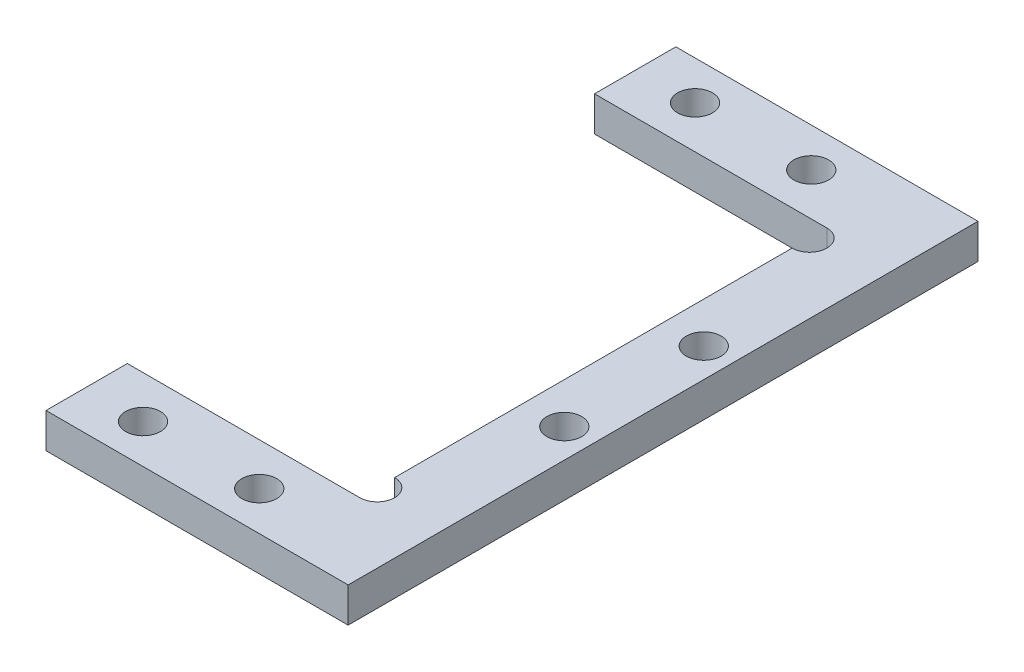
from build123d import *

# Parameters (mm, degrees)
SKETCH_1_W             = 38
SKETCH_1_H             = 7
EXTRUDE_1_DEPTH        = 3
SKETCH_2_W             = 7
SKETCH_2_H             = 3
EXTRUDE_2_DEPTH        = 13
SKETCH_3_R             = 1.5
CUT_EXTRUDE_1_DEPTH    = 44.0464865
SKETCH_4_R             = 1.5
CUT_EXTRUDE_2_DEPTH    = 44.0464865
SKETCH_5_W             = 5
SKETCH_5_H             = 40.2
EXTRUDE_3_DEPTH        = 3
SKETCH_6_R             = 1.5
CUT_EXTRUDE_3_DEPTH    = 56.398916957
FILLET_1_R             = 5
FILLET_2_R             = 5
FILLET_2_OF_MIRROR_1_R = 5
SKETCH_7_W             = 73.096836427
SKETCH_7_H             = 5.118381576
CUT_EXTRUDE_4_DEPTH    = 13
SKETCH_9_W             = 54.2
SKETCH_9_H             = 3
EXTRUDE_4_DEPTH        = 1
SKETCH_8_R             = 1.5
CUT_EXTRUDE_5_DEPTH    = 61.669926652


with BuildPart() as part:
    # 草图1 → 凸台-拉伸1 (new body)
    with BuildSketch(Plane(origin=(0, 0, 0), x_dir=(1, 0, 0), z_dir=(0, 1, 0))):
        with Locations((-19, -3.5)):
            Rectangle(SKETCH_1_W, SKETCH_1_H)
    extrude_1 = extrude(amount=EXTRUDE_1_DEPTH)

    # 草图2 → 凸台-拉伸2 (add)
    with BuildSketch(Plane.XY.offset(7)):
        with Locations((-3.5, 1.5)):
            Rectangle(SKETCH_2_W, SKETCH_2_H)
    extrude(amount=EXTRUDE_2_DEPTH)

    # 草图3 → 切除-拉伸1 (cut, through all)
    with BuildSketch(Plane(origin=(0, 3, 0), x_dir=(1, 0, 0), z_dir=(0, 1, 0))):
        with Locations(Location((-3.5, -15, 0), (0, 0, 270))):
            Circle(SKETCH_3_R)
        with Locations(Location((-3.5, -5, 0), (0, 0, 270))):
            Circle(SKETCH_3_R)
    extrude(amount=-CUT_EXTRUDE_1_DEPTH, mode=Mode.SUBTRACT)

    # 草图4 → 切除-拉伸2 (cut, through all)
    with BuildSketch(Plane(origin=(0, 3, 0), x_dir=(1, 0, 0), z_dir=(0, 1, 0))):
        with Locations(Location((-33, -3.65, 0), (0, 0, 270))):
            Circle(SKETCH_4_R)
        with Locations(Location((-23, -3.65, 0), (0, 0, 270))):
            Circle(SKETCH_4_R)
    cut_extrude_2 = extrude(amount=-CUT_EXTRUDE_2_DEPTH, mode=Mode.SUBTRACT)

    # 草图5 → 凸台-拉伸3 (add)
    with BuildSketch(Plane(origin=(0, 3, 0), x_dir=(1, 0, 0), z_dir=(0, 1, 0))):
        with Locations((-15.5, 20.1)):
            Rectangle(SKETCH_5_W, SKETCH_5_H)
    extrude(amount=-EXTRUDE_3_DEPTH)

    # 草图6 → 切除-拉伸3 (cut, through all)
    with BuildSketch(Plane(origin=(0, 3, 0), x_dir=(1, 0, 0), z_dir=(0, 1, 0))):
        with Locations((-18, 1.5)):
            Circle(SKETCH_6_R)
    cut_extrude_3 = extrude(amount=-CUT_EXTRUDE_3_DEPTH, mode=Mode.SUBTRACT)

    # 圆角1
    fillet_1_edges = [part.edges().sort_by_distance(p)[0] for p in [
        (-7, 1.5, 7),
    ]]
    fillet(fillet_1_edges, radius=FILLET_1_R)

    # 圆角2
    fillet_2_edges = [part.edges().sort_by_distance(p)[0] for p in [
        (-13, 1.5, 0),
    ]]
    fillet(fillet_2_edges, radius=FILLET_2_R)

    # 镜向1: 凸台-拉伸1, 切除-拉伸2, 切除-拉伸3 across plane
    add(extrude_1.mirror(Plane(origin=(0, 0, -20.1), x_dir=(1, 0, 0), z_dir=(0, 0, -1))))
    add(cut_extrude_2.mirror(Plane(origin=(0, 0, -20.1), x_dir=(1, 0, 0), z_dir=(0, 0, -1))), mode=Mode.SUBTRACT)
    add(cut_extrude_3.mirror(Plane(origin=(0, 0, -20.1), x_dir=(1, 0, 0), z_dir=(0, 0, -1))), mode=Mode.SUBTRACT)

    # 圆角2 of 镜向1
    fillet_2_of_mirror_1_edges = [part.edges().sort_by_distance(p)[0] for p in [
        (-13, 1.5, -40.2),
    ]]
    fillet(fillet_2_of_mirror_1_edges, radius=FILLET_2_OF_MIRROR_1_R)

    # 草图7 → 切除-拉伸4 (cut)
    with BuildSketch(Plane(origin=(0, 0, 0), x_dir=(0, 0, -1), z_dir=(1, 0, 0))):
        with Locations((10.651581787, 2.559190788)):
            Rectangle(SKETCH_7_W, SKETCH_7_H)
    extrude(amount=-CUT_EXTRUDE_4_DEPTH, mode=Mode.SUBTRACT)

    # 草图9 → 凸台-拉伸4 (add)
    with BuildSketch(Plane(origin=(-13, 0, 0), x_dir=(0, 0, -1), z_dir=(1, 0, 0))):
        with Locations((20.1, 1.5)):
            Rectangle(SKETCH_9_W, SKETCH_9_H)
    extrude(amount=EXTRUDE_4_DEPTH)

    # 草图8 → 切除-拉伸5 (cut, through all)
    with BuildSketch(Plane(origin=(0, 3, 0), x_dir=(1, 0, 0), z_dir=(0, 1, 0))):
        with Locations(Location((-14.5, 14.1, 0), (0, 0, 270))):
            Circle(SKETCH_8_R)
        with Locations(Location((-14.5, 26.1, 0), (0, 0, 270))):
            Circle(SKETCH_8_R)
    extrude(amount=-CUT_EXTRUDE_5_DEPTH, mode=Mode.SUBTRACT)


solid = part.part
